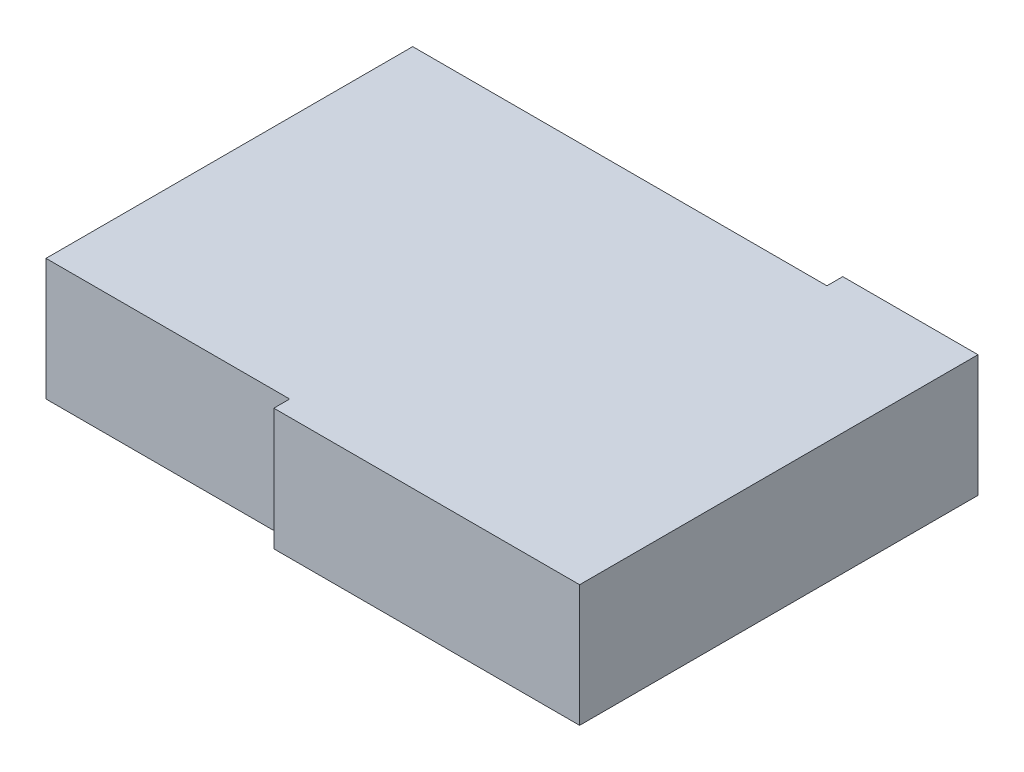
from build123d import *

# Parameters (mm, degrees)
EXTRUDE_1_DEPTH = 10


with BuildPart() as part:
    # 草图1 → 凸台-拉伸1 (new body)
    with BuildSketch(Plane(origin=(0, 0, 0), x_dir=(1, 0, 0), z_dir=(0, 1, 0))):
        Polygon((0.2, -0.2), (34.2, -0.2), (34.2, 1.1), (45.3, 1.1), (45.3, -31.6), (20.2, -31.6), (20.2, -30.3), (0.2, -30.3), align=None)
    extrude(amount=EXTRUDE_1_DEPTH)


solid = part.part
